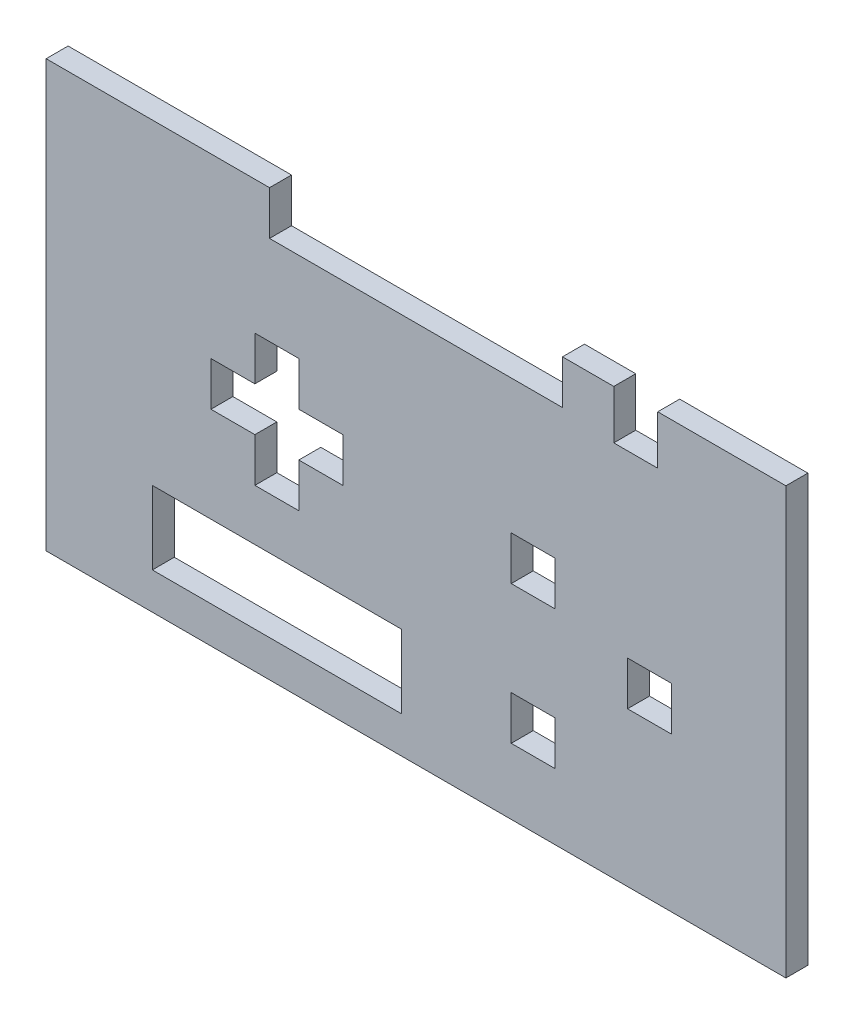
from build123d import *

# Parameters (mm, degrees)
SKETCH1_W           = 101
SKETCH1_H           = 58.2
BOSS_EXTRUDE1_DEPTH = 1.5
SKETCH2_W           = 6
SKETCH2_H           = 6
SKETCH2_W_2         = 40
SKETCH2_H_2         = 8
SKETCH2_W_3         = 34
SKETCH2_H_3         = 10
CUT_EXTRUDE2_DEPTH  = 83.840871555


with BuildPart() as part:
    # Sketch1 → Boss-Extrude1 (new, symmetric)
    with BuildSketch(Plane.XY):
        with Locations((0, -36.5)):
            Rectangle(SKETCH1_W, SKETCH1_H)
    extrude(amount=BOSS_EXTRUDE1_DEPTH, both=True)

    # Sketch2 → Cut-Extrude2 (cut, through all)
    with BuildSketch(Plane.XY.offset(1.5)):
        with Locations((16, -34.713248654)):
            Rectangle(SKETCH2_W, SKETCH2_H)
        with Locations((31.881445826, -41.57558602)):
            Rectangle(SKETCH2_W, SKETCH2_H)
        with Locations((0, -10.4)):
            Rectangle(SKETCH2_W_2, SKETCH2_H)
        with Locations((16, -53.6)):
            Rectangle(SKETCH2_W, SKETCH2_H)
        Polygon((-22, -43.6), (-16, -43.6), (-16, -37.6), (-10, -37.6), (-10, -31.6), (-16, -31.6), (-16, -25.6), (-22, -25.6), (-22, -31.6), (-28, -31.6), (-28, -37.6), (-22, -37.6), align=None)
        with Locations((30, -10.07558602)):
            Rectangle(SKETCH2_W, SKETCH2_H_2)
        with Locations((-19, -55.6)):
            Rectangle(SKETCH2_W_3, SKETCH2_H_3)
    extrude(amount=-CUT_EXTRUDE2_DEPTH, mode=Mode.SUBTRACT)


solid = part.part
